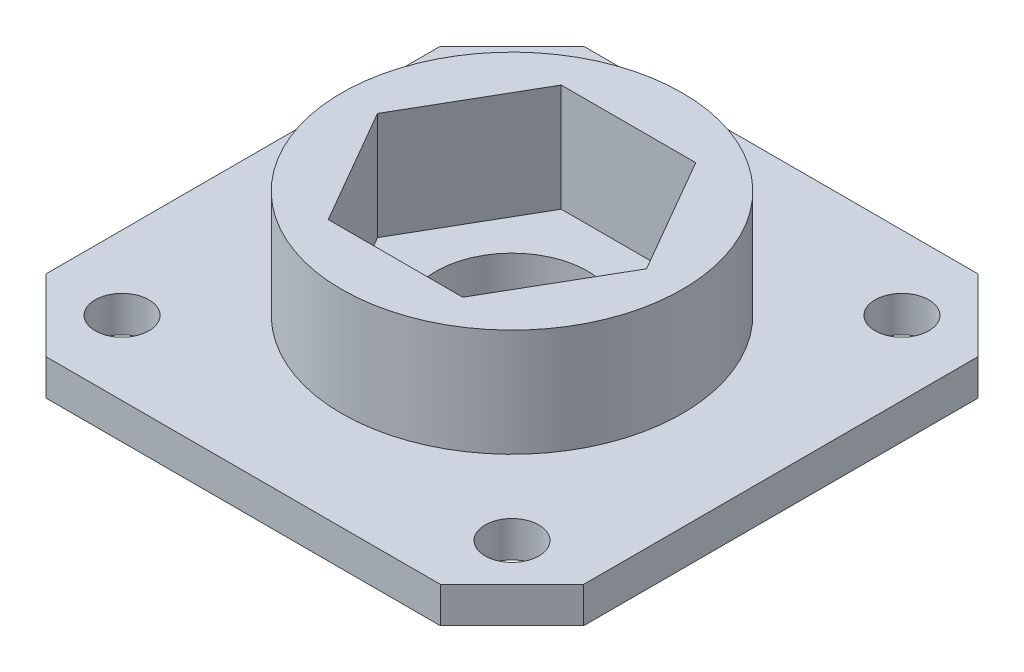
from build123d import *

# Parameters (mm, degrees)
SKETCH1_R           = 4.25
SKETCH1_R_2         = 1.5
BOSS_EXTRUDE1_DEPTH = 2
SKETCH2_R           = 9.5
BOSS_EXTRUDE2_DEPTH = 6


with BuildPart() as part:
    # Sketch1 → Boss-Extrude1 (new body)
    with BuildSketch(Plane(origin=(0, 0, 0), x_dir=(1, 0, 0), z_dir=(0, 1, 0))):
        Polygon((-15, 11), (-11, 15), (11, 15), (15, 11), (15, -11), (11, -15), (-11, -15), (-15, -11), align=None)
        with Locations(Location((0, 0, 0), (0, 0, 270))):
            Circle(SKETCH1_R, mode=Mode.SUBTRACT)
        with Locations(Location((-10.878679656, -10.878679656, 0), (0, 0, 270))):
            Circle(SKETCH1_R_2, mode=Mode.SUBTRACT)
        with Locations(Location((-10.878679656, 10.878679656, 0), (0, 0, 270))):
            Circle(SKETCH1_R_2, mode=Mode.SUBTRACT)
        with Locations(Location((10.878679656, 10.878679656, 0), (0, 0, 270))):
            Circle(SKETCH1_R_2, mode=Mode.SUBTRACT)
        with Locations(Location((10.878679656, -10.878679656, 0), (0, 0, 270))):
            Circle(SKETCH1_R_2, mode=Mode.SUBTRACT)
    extrude(amount=BOSS_EXTRUDE1_DEPTH)

    # Sketch2 → Boss-Extrude2 (add)
    with BuildSketch(Plane(origin=(0, 2, 0), x_dir=(1, 0, 0), z_dir=(0, 1, 0))):
        with Locations(Location((0, 0, 0), (0, 0, 90))):
            Circle(SKETCH2_R)
        Polygon((7.505553499, 0), (3.75277675, 6.5), (-3.75277675, 6.5), (-7.505553499, 0), (-3.75277675, -6.5), (3.75277675, -6.5), align=None, mode=Mode.SUBTRACT)
    extrude(amount=BOSS_EXTRUDE2_DEPTH)


solid = part.part
